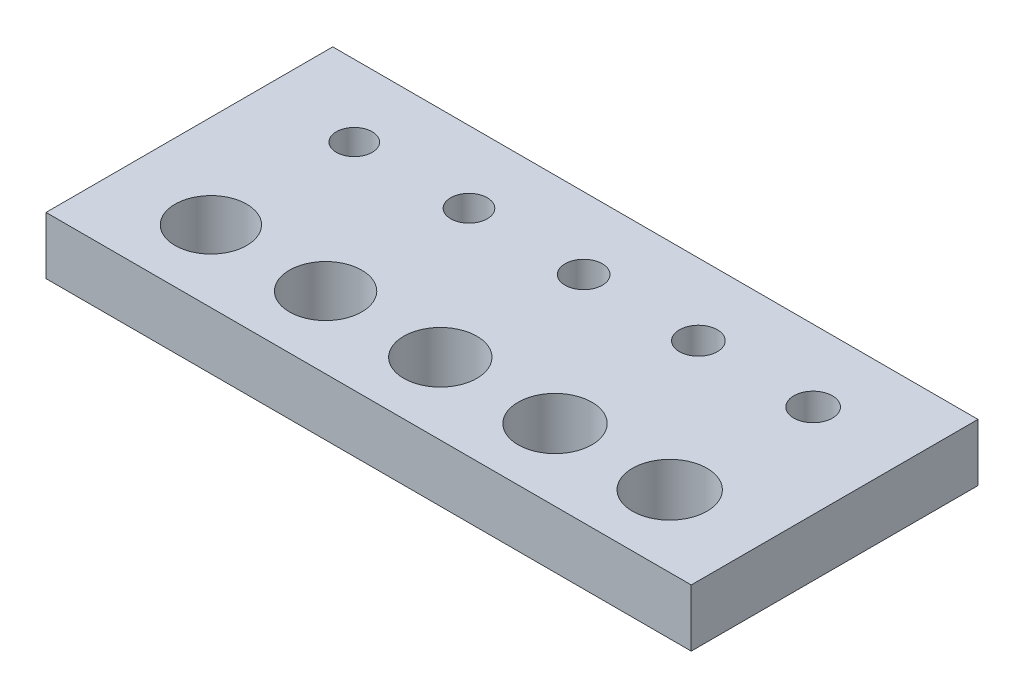
from build123d import *

# Parameters (mm, degrees)
SKETCH1_W         = 90
SKETCH1_H         = 40
PLATE_DEPTH       = 8
SKETCH2_R         = 2.5
SKETCH2_R_2       = 2.55
SKETCH2_R_3       = 2.6
SKETCH2_R_4       = 2.65
SKETCH2_R_5       = 2.7
SKETCH2_R_6       = 5
SKETCH2_R_7       = 5.05
SKETCH2_R_8       = 5.1
SKETCH2_R_9       = 5.15
SKETCH2_R_10      = 5.2
TEST_HOLES_DEPTH  = 50.889878733
BED_CHAMFERS_SIZE = 0.5


with BuildPart() as part:
    # Sketch1 → Plate (new body)
    with BuildSketch(Plane(origin=(0, 0, 0), x_dir=(1, 0, 0), z_dir=(0, 1, 0))):
        Rectangle(SKETCH1_W, SKETCH1_H)
    extrude(amount=PLATE_DEPTH)

    # Sketch2 → Test holes (cut, through all)
    with BuildSketch(Plane(origin=(0, 8, 0), x_dir=(1, 0, 0), z_dir=(0, 1, 0))):
        with Locations(Location((-32, 10, 0), (0, 0, 270))):
            Circle(SKETCH2_R)
        with Locations(Location((-16, 10, 0), (0, 0, 270))):
            Circle(SKETCH2_R_2)
        with Locations(Location((0, 10, 0), (0, 0, 270))):
            Circle(SKETCH2_R_3)
        with Locations(Location((16, 10, 0), (0, 0, 270))):
            Circle(SKETCH2_R_4)
        with Locations(Location((32, 10, 0), (0, 0, 270))):
            Circle(SKETCH2_R_5)
        with Locations(Location((-32, -10, 0), (0, 0, 270))):
            Circle(SKETCH2_R_6)
        with Locations(Location((-16, -10, 0), (0, 0, 270))):
            Circle(SKETCH2_R_7)
        with Locations(Location((0, -10, 0), (0, 0, 270))):
            Circle(SKETCH2_R_8)
        with Locations(Location((16, -10, 0), (0, 0, 270))):
            Circle(SKETCH2_R_9)
        with Locations(Location((32, -10, 0), (0, 0, 270))):
            Circle(SKETCH2_R_10)
    extrude(amount=-TEST_HOLES_DEPTH, mode=Mode.SUBTRACT)

    # Bed chamfers
    bed_chamfers_edges = [part.edges().sort_by_distance(p)[0] for p in [
        (-16, 0, -12.55),
        (0, 0, -12.6),
        (16, 0, -12.65),
        (32, 0, -12.7),
        (-32, 0, 5),
        (-16, 0, 4.95),
        (0, 0, 4.9),
        (16, 0, 4.85),
        (32, 0, 4.8),
        (-32, 0, -12.5),
    ]]
    chamfer(bed_chamfers_edges, length=BED_CHAMFERS_SIZE)


solid = part.part
